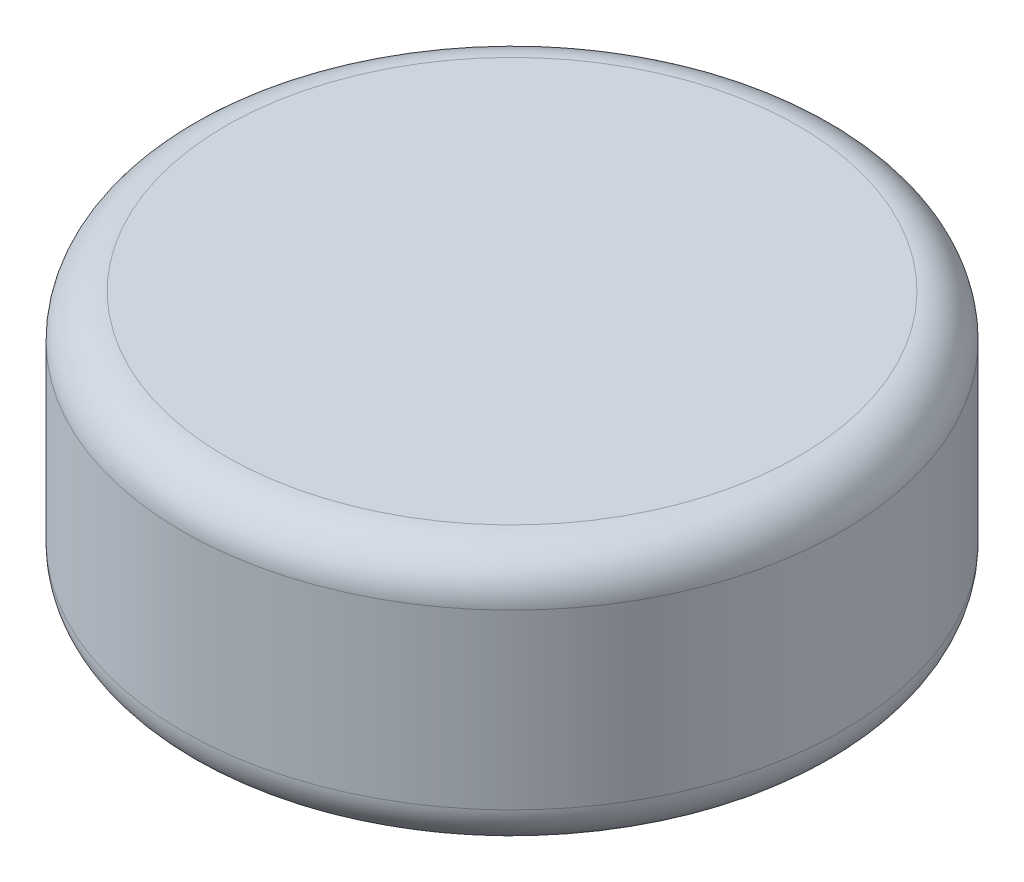
from build123d import *

# Parameters (mm, degrees)
SKETCH1_R           = 76.2
BOSS_EXTRUDE1_DEPTH = 60
FILLET3_R           = 10


with BuildPart() as part:
    # Sketch1 → Boss-Extrude1 (new body)
    with BuildSketch(Plane(origin=(0, 0, 0), x_dir=(1, 0, 0), z_dir=(0, 1, 0))):
        with Locations(Location((0, 0, 0), (0, 0, 270))):
            Circle(SKETCH1_R)
    extrude(amount=BOSS_EXTRUDE1_DEPTH)

    # Fillet3
    fillet3_edges = [part.edges().sort_by_distance(p)[0] for p in [
        (0, 0, -76.2),
        (0, 60, -76.2),
    ]]
    fillet(fillet3_edges, radius=FILLET3_R)


solid = part.part
